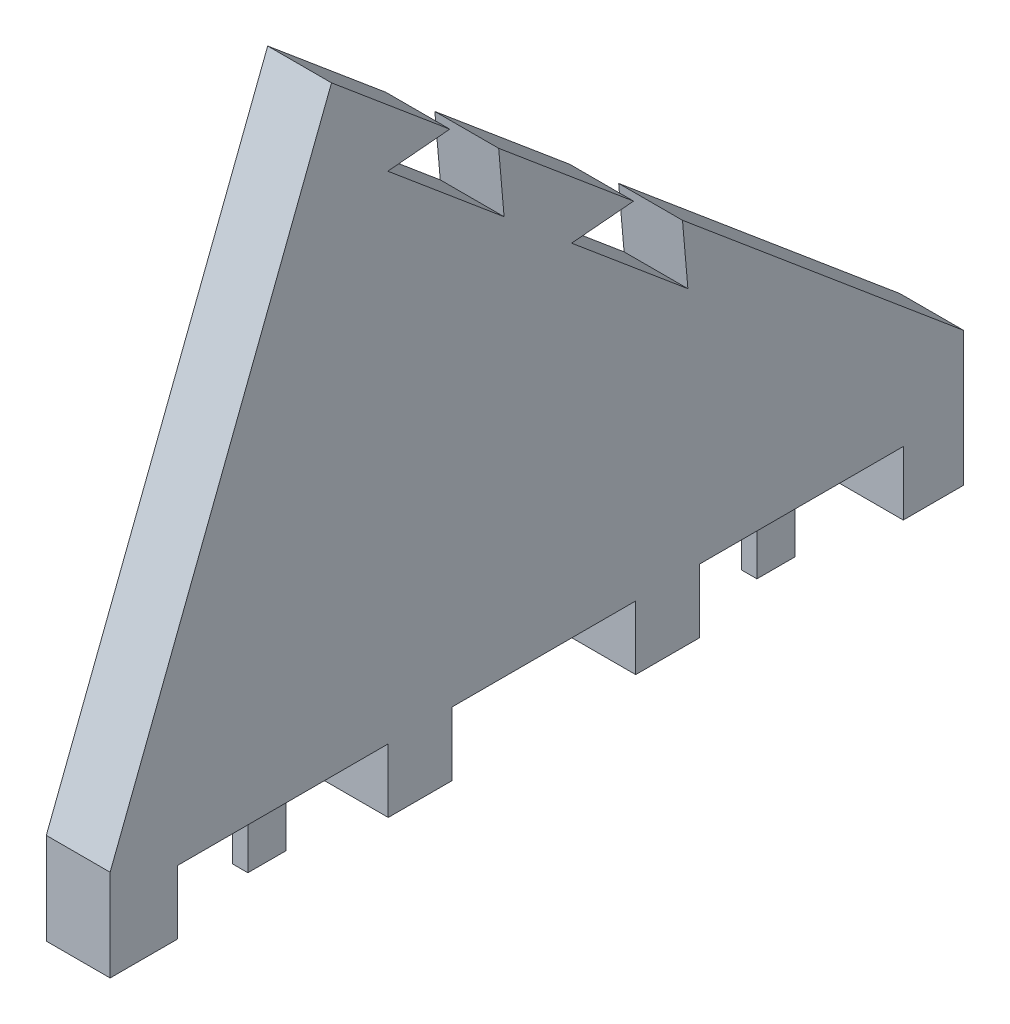
from build123d import *

# Parameters (mm, degrees)
BOSS_EXTRUDE2_DEPTH = 5
BOSS_EXTRUDE3_START = 2.05
SKETCH2_4_W         = 3
SKETCH2_4_H         = 5
BOSS_EXTRUDE3_DEPTH = 1.2


with BuildPart() as part:
    # Sketch2 → Boss-Extrude2 (new body)
    with BuildSketch(Plane(origin=(0, 0, 0), x_dir=(0, 0, -1), z_dir=(1, 0, 0))):
        Polygon((7.192857145, 5.102e-06), (12.192857145, 5.102e-06), (12.192857145, 4.998838637), (18.442857145, 4.998838637), (21.442857145, 4.998838637), (27.892857145, 4.998838637), (28.158909208, 4.998838637), (28.158909208, 0.00505468), (32.892857145, 0.00505468), (32.892857145, 10.509453346), (17.646665318, 23.302527285), (14.567046792, 25.886634054), (10.859778292, 28.997401685), (11.284525034, 24.142524207), (2.174678599, 31.786592991), (7.029556077, 32.211339733), (-3.541857238, 41.081808747), (-3.117110496, 36.226931269), (-12.226956931, 43.871000053), (-7.372079454, 44.295746795), (-16.638484456, 52.071183815), (-32.892857145, 10.00505468), (-33.983618254, 7.182177505), (-33.983618254, 0.00505468), (-32.892857145, 0.00505468), (-28.691927734, 0.00505468), (-28.691927734, 4.998838637), (-27.892857145, 4.998838637), (-21.442857145, 4.998838637), (-18.442857145, 4.998838637), (-12.192857145, 4.998838637), (-12.192857145, 4.163e-06), (-7.192857145, 4.163e-06), (-7.192857145, 5.000004163), (7.192857145, 5.000004163), align=None)
    extrude(amount=BOSS_EXTRUDE2_DEPTH)

    # Sketch2<4> → Boss-Extrude3 (add)
    with BuildSketch(Plane(origin=(0, 0, 0), x_dir=(0, 0, -1), z_dir=(1, 0, 0)).offset(BOSS_EXTRUDE3_START)):
        with Locations((19.942857145, 2.498838637)):
            Rectangle(SKETCH2_4_W, SKETCH2_4_H)
        with Locations((-19.942857145, 2.498838637)):
            Rectangle(SKETCH2_4_W, SKETCH2_4_H)
    extrude(amount=BOSS_EXTRUDE3_DEPTH)


solid = part.part
